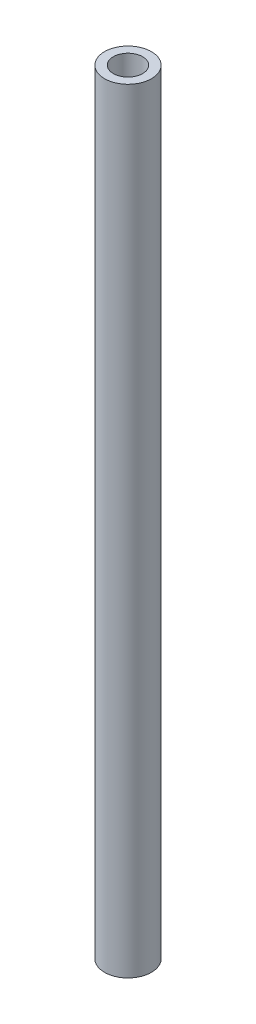
from build123d import *

# Parameters (mm, degrees)
SKETCH1_R           = 25.4
SKETCH1_R_2         = 15.875
BOSS_EXTRUDE1_DEPTH = 838.2
CUT_EXTRUDE3_DEPTH  = 5.08


with BuildPart() as part:
    # Sketch1 → Boss-Extrude1 (new body)
    with BuildSketch(Plane(origin=(0, 0, 0), x_dir=(1, 0, 0), z_dir=(0, 1, 0))):
        with Locations(Location((0, 0, 0), (0, 0, 270))):
            Circle(SKETCH1_R)
        with Locations(Location((0, 0, 0), (0, 0, 270))):
            Circle(SKETCH1_R_2, mode=Mode.SUBTRACT)
    extrude(amount=BOSS_EXTRUDE1_DEPTH)

    # Sketch5 → Cut-Extrude3 (cut)
    with BuildSketch(Plane.XZ):
        with BuildLine():
            Line((-20.9422761, -0.95712788), (-20.322794931, -0.95712788))
            add(Edge.make_bspline(
                [(-20.322794931, -0.95712788), (-20.292470525, -0.957287311), (-20.233694281, -0.957596328), (-20.148223787, -0.962388882), (-20.068169509, -0.96892364), (-19.99350823, -0.979292367), (-19.92427445, -0.991803479), (-19.860259522, -1.006954412), (-19.801667008, -1.025121412), (-19.73171474, -1.054010538), (-19.651958141, -1.096939412), (-19.565599599, -1.160374611), (-19.491754325, -1.237964774), (-19.428085308, -1.325488325), (-19.377465721, -1.421768633), (-19.340845001, -1.524510897), (-19.317660357, -1.632389906), (-19.315275992, -1.706451931), (-19.314070972, -1.743881687)],
                knots=[0, 0, 0, 0, 1.001505555, 1.941167018, 2.826882275, 3.653841531, 4.429895133, 5.150066043, 5.825578002, 6.45369114, 7.647487171, 8.808567382, 9.977351308, 11.170798116, 12.373658725, 13.556498008, 14.765093433, 16, 16, 16, 16], degree=3))
            add(Edge.make_bspline(
                [(-19.314070972, -1.743881687), (-19.315062678, -1.778945076), (-19.317011472, -1.847847944), (-19.335646689, -1.948626172), (-19.36482101, -2.044557634), (-19.405375057, -2.135292227), (-19.458081868, -2.218779862), (-19.5205462, -2.295694024), (-19.595908728, -2.362778198), (-19.652372239, -2.400282116), (-19.681053144, -2.419332408)],
                knots=[0, 0, 0, 0, 1.044552857, 2.05264487, 3.044412934, 4.028983338, 5.005914585, 5.980388656, 6.974128949, 8, 8, 8, 8], degree=3))
            add(Edge.make_bspline(
                [(-19.681053144, -2.419332408), (-19.644984756, -2.433179942), (-19.575976995, -2.459673707), (-19.481011827, -2.506514449), (-19.399192217, -2.557461506), (-19.329889092, -2.613098256), (-19.270618505, -2.673068392), (-19.218863336, -2.738251245), (-19.174702376, -2.809497119), (-19.136862795, -2.886063183), (-19.107336423, -2.967167622), (-19.085223996, -3.052049683), (-19.072553524, -3.140404994), (-19.07075045, -3.200535302), (-19.069840203, -3.230890901)],
                knots=[0, 0, 0, 0, 1.27268992, 2.434971085, 3.483601985, 4.442670788, 5.356604649, 6.2567628, 7.179492994, 8.113709626, 9.066344395, 10.018646069, 10.999752585, 12, 12, 12, 12], degree=3))
            add(Edge.make_bspline(
                [(-19.069840203, -3.230890901), (-19.070726342, -3.261885135), (-19.072469845, -3.322867159), (-19.085333105, -3.412452174), (-19.107112795, -3.498063733), (-19.137113049, -3.580255577), (-19.176267435, -3.658868699), (-19.223917802, -3.73399216), (-19.280733578, -3.80487116), (-19.344290609, -3.872293304), (-19.416192698, -3.932915654), (-19.493767704, -3.986904902), (-19.57799258, -4.031305972), (-19.667484032, -4.068604078), (-19.763245947, -4.097094893), (-19.864848313, -4.117027157), (-19.972203501, -4.13045744), (-20.045872346, -4.131561619), (-20.083652302, -4.13212788)],
                knots=[0, 0, 0, 0, 0.978564426, 1.925352924, 2.850884081, 3.763762016, 4.682927383, 5.618979971, 6.567305752, 7.547517671, 8.540179244, 9.531824382, 10.526200242, 11.540722885, 12.589160233, 13.674978461, 14.80764778, 16, 16, 16, 16], degree=3))
            Line((-20.083652302, -4.13212788), (-20.9422761, -4.13212788))
            Line((-20.9422761, -4.13212788), (-20.9422761, -0.95712788))
        make_face()
        with BuildLine():
            Line((-20.657340203, -1.282768906), (-20.657340203, -2.300397111))
            Line((-20.657340203, -2.300397111), (-20.465898897, -2.300397111))
            add(Edge.make_bspline(
                [(-20.465898897, -2.300397111), (-20.437914633, -2.300034324), (-20.383843331, -2.299333345), (-20.305538853, -2.297325369), (-20.232854015, -2.291702858), (-20.165914281, -2.286081963), (-20.104825064, -2.276942873), (-20.049721704, -2.266064304), (-19.999739405, -2.254559097), (-19.94209996, -2.234992491), (-19.8767195, -2.206074886), (-19.807020898, -2.161196863), (-19.745576058, -2.107744057), (-19.693690038, -2.046066542), (-19.651225347, -1.978152216), (-19.621730762, -1.905084689), (-19.601730726, -1.828684998), (-19.599924123, -1.776235583), (-19.59900687, -1.749605845)],
                knots=[0, 0, 0, 0, 1.156816544, 2.235205308, 3.236616184, 4.169592532, 5.011045266, 5.787822928, 6.49130361, 7.128639758, 8.301311294, 9.436451833, 10.541879658, 11.654887649, 12.756523258, 13.837046038, 14.901820046, 16, 16, 16, 16], degree=3))
            add(Edge.make_bspline(
                [(-19.59900687, -1.749605845), (-19.59948419, -1.731983895), (-19.600420507, -1.697416516), (-19.60808886, -1.647025317), (-19.621122302, -1.59963277), (-19.637862983, -1.554589398), (-19.661257007, -1.513303648), (-19.688801006, -1.474348035), (-19.722080168, -1.439049185), (-19.759960016, -1.406056854), (-19.803510695, -1.376806461), (-19.852706224, -1.351188054), (-19.908212189, -1.330558921), (-19.969093136, -1.312492126), (-20.036286194, -1.299802745), (-20.109015967, -1.289231458), (-20.187878176, -1.283849613), (-20.242438377, -1.283137177), (-20.270641485, -1.282768906)],
                knots=[0, 0, 0, 0, 0.91205012, 1.789085906, 2.630437955, 3.453916878, 4.269457761, 5.079663411, 5.91843418, 6.774407191, 7.675494373, 8.627863946, 9.638891023, 10.736472738, 11.911756761, 13.175263542, 14.539845004, 16, 16, 16, 16], degree=3))
            Line((-20.270641485, -1.282768906), (-20.657340203, -1.282768906))
        make_face(mode=Mode.SUBTRACT)
        with BuildLine():
            Line((-20.657340203, -2.626038137), (-20.657340203, -3.806486855))
            Line((-20.657340203, -3.806486855), (-20.251560956, -3.806486855))
            add(Edge.make_bspline(
                [(-20.251560956, -3.806486855), (-20.222515216, -3.806138741), (-20.166533382, -3.805467798), (-20.085705837, -3.803277452), (-20.010791164, -3.798295173), (-19.942131213, -3.790452152), (-19.878984588, -3.781944559), (-19.822108814, -3.770504326), (-19.771042846, -3.757397055), (-19.711829724, -3.73713677), (-19.645151542, -3.705662114), (-19.573295979, -3.658205637), (-19.509409338, -3.601669494), (-19.455157425, -3.53623645), (-19.410695642, -3.465088032), (-19.378351051, -3.389663322), (-19.358402202, -3.311208593), (-19.355987234, -3.257717361), (-19.3547761, -3.230890901)],
                knots=[0, 0, 0, 0, 1.160039823, 2.235823828, 3.228722157, 4.157150951, 4.99529583, 5.772374946, 6.472645482, 7.099169577, 8.269452708, 9.405989375, 10.527446681, 11.663510218, 12.788923519, 13.866172445, 14.929861265, 16, 16, 16, 16], degree=3))
            add(Edge.make_bspline(
                [(-19.3547761, -3.230890901), (-19.355026567, -3.2141148), (-19.355523459, -3.180833196), (-19.363017016, -3.131923846), (-19.373915313, -3.084547518), (-19.388004542, -3.038575568), (-19.40852363, -2.994839148), (-19.432478139, -2.952473254), (-19.460564553, -2.911421884), (-19.504328903, -2.859522197), (-19.567984918, -2.799726049), (-19.658433207, -2.741181315), (-19.761278077, -2.693966519), (-19.83587016, -2.673919136), (-19.874402503, -2.663563177)],
                knots=[0, 0, 0, 0, 0.723448775, 1.435228256, 2.130040452, 2.821711965, 3.505591119, 4.210454504, 4.921174351, 5.648778258, 7.137944449, 8.670945889, 10.280296675, 12, 12, 12, 12], degree=3))
            add(Edge.make_bspline(
                [(-19.874402503, -2.663563177), (-19.889850325, -2.660428922), (-19.923344391, -2.653633211), (-19.977961268, -2.646459795), (-20.04031452, -2.640068919), (-20.11054813, -2.635341655), (-20.188750958, -2.63045529), (-20.27509002, -2.628554988), (-20.369212726, -2.626287802), (-20.434520093, -2.626123488), (-20.468442967, -2.626038137)],
                knots=[0, 0, 0, 0, 0.634451884, 1.375622551, 2.216452059, 3.157844607, 4.20941857, 5.370758133, 6.634282058, 8, 8, 8, 8], degree=3))
            Line((-20.468442967, -2.626038137), (-20.657340203, -2.626038137))
        make_face(mode=Mode.SUBTRACT)
    extrude(amount=-CUT_EXTRUDE3_DEPTH, mode=Mode.SUBTRACT)


solid = part.part
